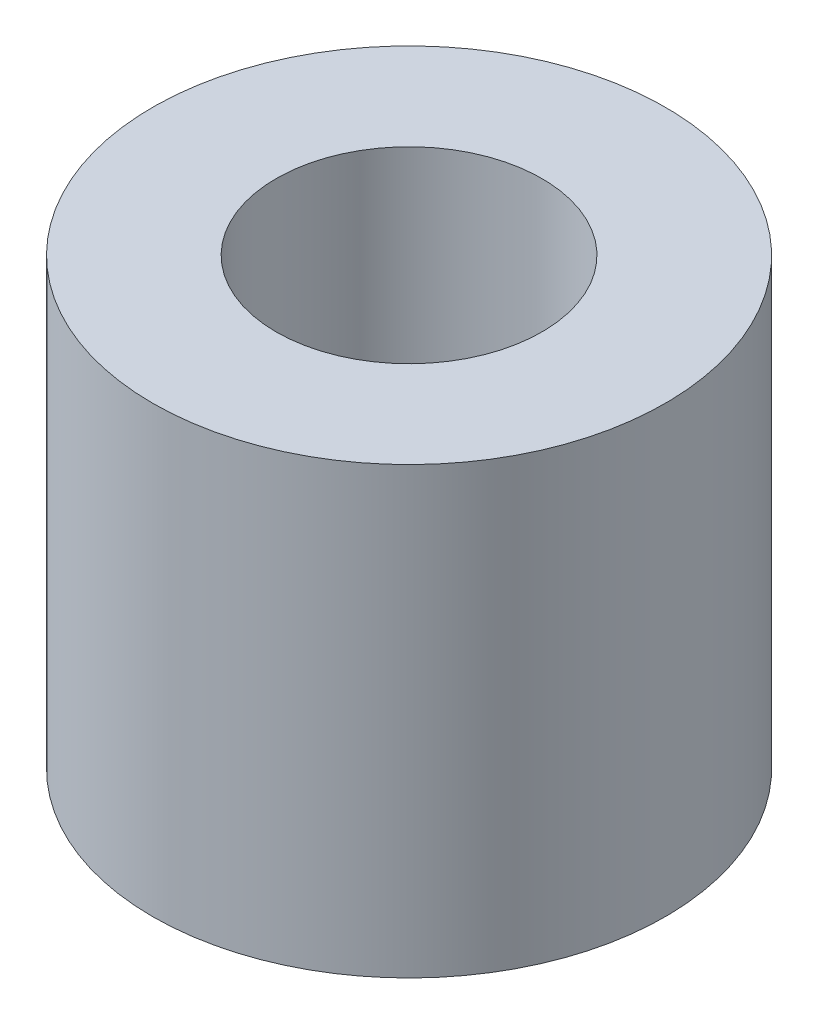
from build123d import *

# Parameters (mm, degrees)
SKETCH1_R           = 3.96875
SKETCH1_R_2         = 2.0574
BOSS_EXTRUDE1_DEPTH = 6.8834


with BuildPart() as part:
    # Sketch1 → Boss-Extrude1 (new body)
    with BuildSketch(Plane(origin=(0, 0, 0), x_dir=(1, 0, 0), z_dir=(0, 1, 0))):
        with Locations(Location((0, 0, 0), (0, 0, 270))):
            Circle(SKETCH1_R)
        with Locations(Location((0, 0, 0), (0, 0, 270))):
            Circle(SKETCH1_R_2, mode=Mode.SUBTRACT)
    extrude(amount=BOSS_EXTRUDE1_DEPTH)


solid = part.part
